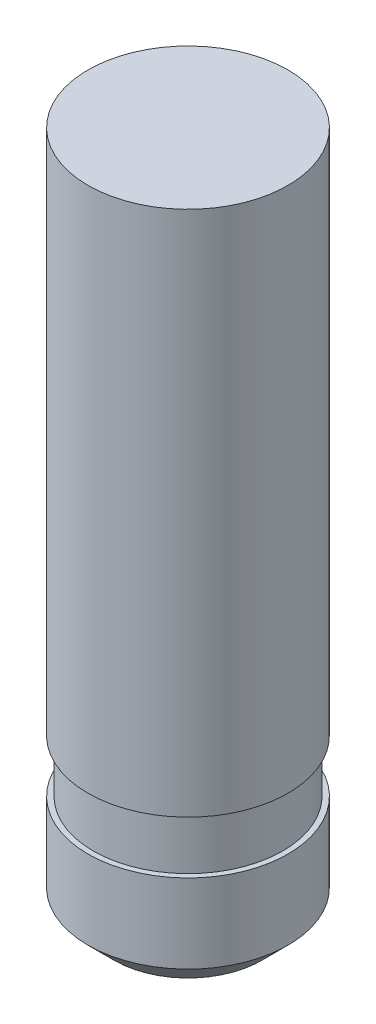
from build123d import *

# Parameters (mm, degrees)
SKETCH1_R           = 1.9
BOSS_EXTRUDE1_DEPTH = 2
SKETCH2_R           = 1.8
BOSS_EXTRUDE2_DEPTH = 1
SKETCH3_R           = 1.9
BOSS_EXTRUDE3_DEPTH = 10
CHAMFER1_SIZE       = 0.5


with BuildPart() as part:
    # Sketch1 → Boss-Extrude1 (new body)
    with BuildSketch(Plane(origin=(0, 0, 0), x_dir=(1, 0, 0), z_dir=(0, 1, 0))):
        with Locations(Location((0, 0, 0), (0, 0, 270))):
            Circle(SKETCH1_R)
    extrude(amount=BOSS_EXTRUDE1_DEPTH)

    # Sketch2 → Boss-Extrude2 (add)
    with BuildSketch(Plane(origin=(0, 2, 0), x_dir=(1, 0, 0), z_dir=(0, 1, 0))):
        with Locations(Location((0, 0, 0), (0, 0, 270))):
            Circle(SKETCH2_R)
    extrude(amount=BOSS_EXTRUDE2_DEPTH)

    # Sketch3 → Boss-Extrude3 (add)
    with BuildSketch(Plane(origin=(0, 3, 0), x_dir=(1, 0, 0), z_dir=(0, 1, 0))):
        with Locations(Location((0, 0, 0), (0, 0, 270))):
            Circle(SKETCH3_R)
    extrude(amount=BOSS_EXTRUDE3_DEPTH)

    # Chamfer1
    chamfer1_edges = [part.edges().sort_by_distance(p)[0] for p in [
        (0, 0, -1.9),
    ]]
    chamfer(chamfer1_edges, length=CHAMFER1_SIZE)


solid = part.part
